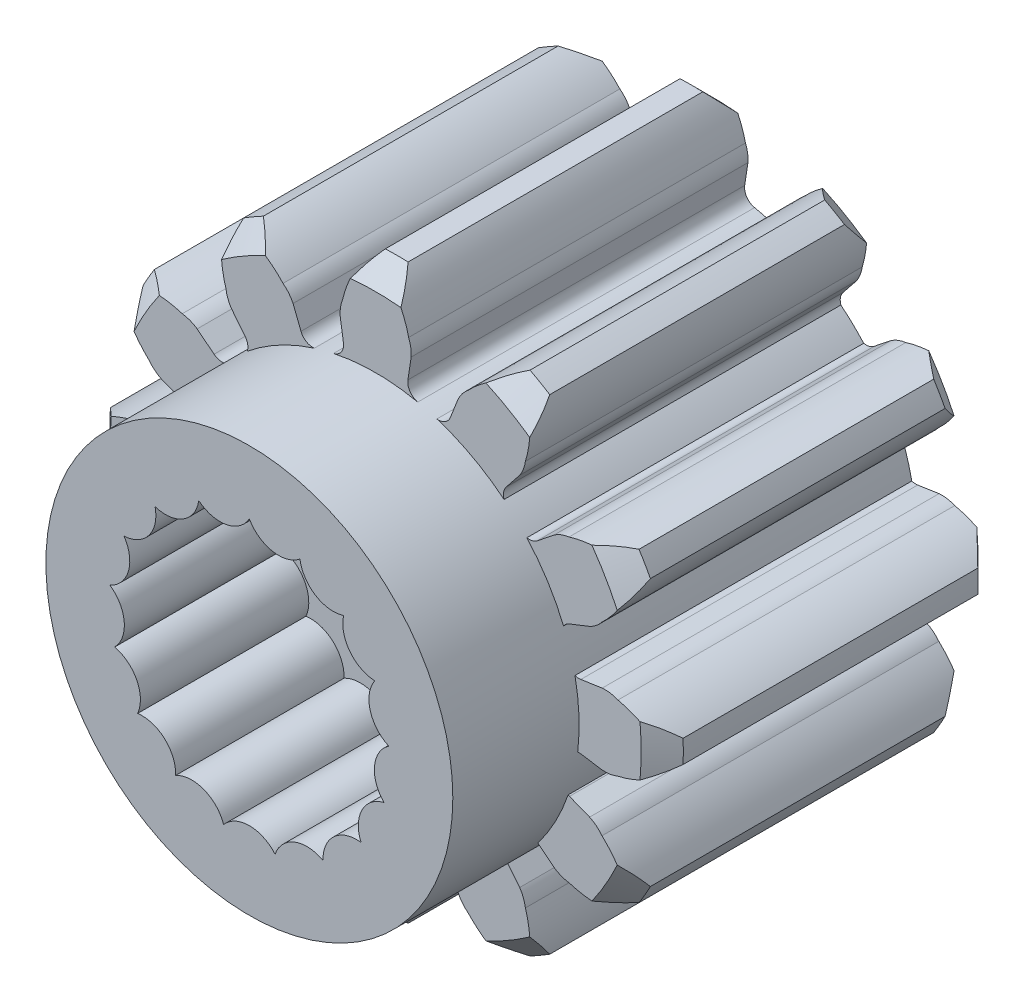
from build123d import *
from build123d.topology import SkipClean

# Parameters (mm, degrees)
SKETCH1_R                    = 4.833
BOSS_EXTRUDE1_DEPTH          = 8
BOSS_EXTRUDE2_DEPTH          = 8
CHAMFER1_SIZE                = 0.5
CIRPATTERN2_COUNT            = 12
CHAMFER1_OF_CIRPATTERN2_SIZE = 0.5
SKETCH5_R                    = 4.833
BOSS_EXTRUDE3_DEPTH          = 3
CUT_EXTRUDE2_DEPTH           = 4


with BuildPart() as part:
    # Sketch1 → Boss-Extrude1 (new body)
    with BuildSketch(Plane.XY):
        Circle(SKETCH1_R)
    extrude(amount=BOSS_EXTRUDE1_DEPTH)

    # Sketch2 → Boss-Extrude2 (add, through all)
    with BuildSketch(Plane.XY.offset(8)):
        with BuildLine():
            Line((0.765839864, 5.066673297), (0.842649147, 5.574831154))
            ThreePointArc((0.842649147, 5.574831154), (0.835145424, 5.765176716), (0.78371416, 5.94859581))
            ThreePointArc((0.78371416, 5.94859581), (0.587169015, 6.501190097), (0.270368272, 6.994776694))
            ThreePointArc((0.270368272, 6.994776694), (0, 7), (-0.270368272, 6.994776694))
            ThreePointArc((-0.270368272, 6.994776694), (-0.587169015, 6.501190097), (-0.78371416, 5.94859581))
            ThreePointArc((-0.78371416, 5.94859581), (-0.835145424, 5.765176716), (-0.842649147, 5.574831154))
            Line((-0.842649147, 5.574831154), (-0.765839864, 5.066673297))
            ThreePointArc((-0.765839864, 5.066673297), (-0.815914827, 4.850926567), (-1.000373974, 4.728333841))
            ThreePointArc((-1.000373974, 4.728333841), (0, 4.833), (1.000373974, 4.728333841))
            ThreePointArc((1.000373974, 4.728333841), (0.815914827, 4.850926567), (0.765839864, 5.066673297))
        make_face()
    boss_extrude2 = extrude(amount=-BOSS_EXTRUDE2_DEPTH)

    # Chamfer1
    chamfer1_edges = [part.edges().sort_by_distance(p)[0] for p in [
        (0, 7, 0),
        (0, 7, 8),
    ]]
    chamfer(chamfer1_edges, length=CHAMFER1_SIZE)

    # CirPattern2: Boss-Extrude2 ×12 about axis
    cirpattern2_axis = Axis((0, 0.19286907, 0), (0, 0, 1))
    for i in range(1, CIRPATTERN2_COUNT):
        add(boss_extrude2.rotate(cirpattern2_axis, i * 360 / CIRPATTERN2_COUNT))

    # Chamfer1 of CirPattern2
    chamfer1_of_cirpattern2_edges = [part.edges().sort_by_distance(p)[0] for p in [
        (-3.403565465, 6.088017382, 0),
        (-3.403565465, 6.088017382, 8),
        (-5.895148313, 3.596434535, 0),
        (-5.895148313, 3.596434535, 8),
        (-6.80713093, 0.19286907, 0),
        (-6.80713093, 0.19286907, 8),
        (-5.895148313, -3.210696396, 0),
        (-5.895148313, -3.210696396, 8),
        (-3.403565465, -5.702279243, 0),
        (-3.403565465, -5.702279243, 8),
        (0, -6.614261861, 0),
        (0, -6.614261861, 8),
        (3.403565465, -5.702279243, 0),
        (3.403565465, -5.702279243, 8),
        (5.895148313, -3.210696396, 0),
        (5.895148313, -3.210696396, 8),
        (6.80713093, 0.19286907, 0),
        (6.80713093, 0.19286907, 8),
        (5.895148313, 3.596434535, 0),
        (5.895148313, 3.596434535, 8),
        (3.403565465, 6.088017382, 0),
        (3.403565465, 6.088017382, 8),
    ]]
    chamfer(chamfer1_of_cirpattern2_edges, length=CHAMFER1_OF_CIRPATTERN2_SIZE)

    # Sketch5 → Boss-Extrude3 (add)
    with BuildSketch(Plane.XY.offset(8)):
        with Locations(Location((0, 0, 0), (0, 0, 186.786168362))):
            Circle(SKETCH5_R)
    extrude(amount=BOSS_EXTRUDE3_DEPTH)

    # Sketch4 → Cut-Extrude2 (cut)
    with SkipClean():  # the faces are left unmerged after this step: merging them gives an invalid solid
        with BuildSketch(Plane.XY.offset(11)):
            with BuildLine():
                ThreePointArc((-2.240038015, 2.45720465), (-1.571312695, 2.537757138), (-1.20112854, 3.100470163))
                ThreePointArc((-1.20112854, 3.100470163), (-0.548461835, 2.934011672), (0, 3.325))
                ThreePointArc((0, 3.325), (0.548461835, 2.934011672), (1.20112854, 3.100470163))
                ThreePointArc((1.20112854, 3.100470163), (1.571312695, 2.537757138), (2.240038015, 2.45720465))
                ThreePointArc((2.240038015, 2.45720465), (2.381949069, 1.79876444), (2.976417944, 1.482080033))
                ThreePointArc((2.976417944, 1.482080033), (2.870890022, 0.816838637), (3.310816136, 0.306792295))
                ThreePointArc((3.310816136, 0.306792295), (2.97210137, -0.27540575), (3.198070264, -0.909929442))
                ThreePointArc((3.198070264, -0.909929442), (2.671913958, -1.330455064), (2.653407281, -2.003760166))
                ThreePointArc((2.653407281, -2.003760166), (2.010869761, -2.20581905), (1.750386942, -2.826971976))
                ThreePointArc((1.750386942, -2.826971976), (1.07824646, -2.78327495), (0.610967147, -3.268385556))
                ThreePointArc((0.610967147, -3.268385556), (0, -2.984834146), (-0.610967147, -3.268385556))
                ThreePointArc((-0.610967147, -3.268385556), (-1.07824646, -2.78327495), (-1.750386942, -2.826971976))
                ThreePointArc((-1.750386942, -2.826971976), (-2.010869761, -2.20581905), (-2.653407281, -2.003760166))
                ThreePointArc((-2.653407281, -2.003760166), (-2.671913958, -1.330455064), (-3.198070264, -0.909929442))
                ThreePointArc((-3.198070264, -0.909929442), (-2.97210137, -0.27540575), (-3.310816136, 0.306792295))
                ThreePointArc((-3.310816136, 0.306792295), (-2.870890022, 0.816838637), (-2.976417944, 1.482080033))
                ThreePointArc((-2.976417944, 1.482080033), (-2.381949069, 1.79876444), (-2.240038015, 2.45720465))
            make_face()
        extrude(amount=-CUT_EXTRUDE2_DEPTH, mode=Mode.SUBTRACT)


solid = part.part
